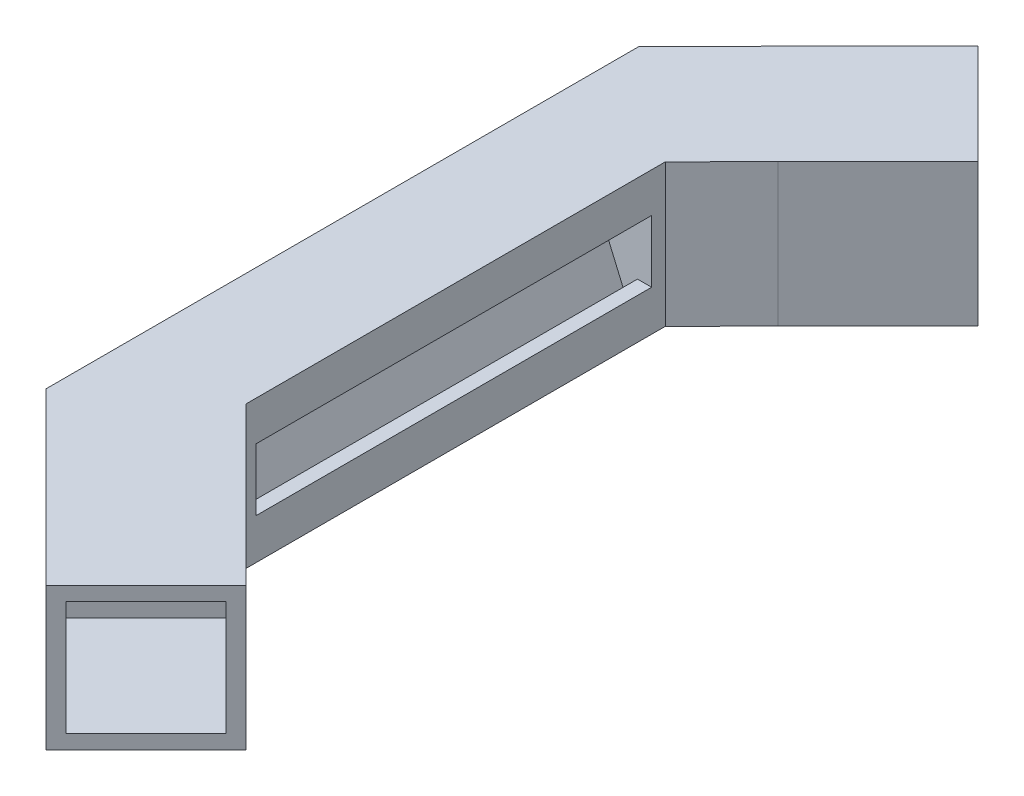
from build123d import *

# Parameters (mm, degrees)
EXTRUDE_1_DEPTH          = 2.5
EXTRUDE_2_DEPTH          = 20.2
EXTRUDE_3_DEPTH          = 2.5
CUT_EXTRUDE_1_DEPTH      = 35
CUT_EXTRUDE_1_DEPTH_BACK = 35


with BuildPart() as part:
    # 스케치1 → 보스-돌출1 (new body)
    with BuildSketch(Plane(origin=(0, 0, 0), x_dir=(1, 0, 0), z_dir=(0, 1, 0))):
        Polygon((-40.78505036, -82.204604484), (-58.462719889, -64.526934954), (-70.873239565, -52.116415278), (-70.873239565, 52.78521642), (-58.606071899, 65.106091447), (-40.92840237, 82.783760977), (-23.25073284, 65.106091447), (-40.92391218, 47.432912107), (-50.873239565, 37.425795029), (-50.873239565, -36.761076219), (-40.78505036, -46.849265425), (-23.10738083, -64.526934954), align=None)
    extrude(amount=EXTRUDE_1_DEPTH)

    # 스케치2 → 보스-돌출2 (add)
    with BuildSketch(Plane(origin=(0, 2.5, 0), x_dir=(1, 0, 0), z_dir=(0, 1, 0))):
        Polygon((-25.018499793, 66.8738584), (-42.694238669, 49.198119524), (-56.836374293, 63.340255148), (-39.160635417, 81.015994024), (-40.92840237, 82.783760977), (-58.606071899, 65.106091447), (-70.873239565, 52.78521642), (-70.873239565, -52.116415278), (-40.78505036, -82.204604484), (-39.017283407, -80.436837531), (-56.694952937, -62.759168001), (-42.552817313, -48.617032378), (-24.875147783, -66.294701907), (-23.10738083, -64.526934954), (-50.873239565, -36.761076219), (-50.873239565, 37.425795029), (-40.92391218, 47.432912107), (-23.25073284, 65.106091447), align=None)
    extrude(amount=EXTRUDE_2_DEPTH)

    # 스케치3 → 보스-돌출3 (add)
    with BuildSketch(Plane(origin=(0, 22.7, 0), x_dir=(1, 0, 0), z_dir=(0, 1, 0))):
        Polygon((-40.78505036, -82.204604484), (-23.10738083, -64.526934954), (-50.873239565, -36.761076219), (-50.873239565, 37.425795029), (-40.92391218, 47.432912107), (-23.25073284, 65.106091447), (-40.92840237, 82.783760977), (-58.606071899, 65.106091447), (-70.873239565, 52.78521642), (-70.873239565, -52.116415278), align=None)
    extrude(amount=EXTRUDE_3_DEPTH)

    # 스케치4 → 컷-돌출1 (cut, two sides: drawn at the far end of the back side and taken through both)
    with BuildSketch(Plane.XY.offset(-CUT_EXTRUDE_1_DEPTH_BACK)):
        Polygon((-50.873239565, 18.2), (-50.873239565, 16.507811734), (-50.873239565, 8.892188266), (-50.873239565, 7.2), (-53.373239565, 7.2), (-53.373239565, 2.2), (-54.873239565, 2.2), (-59.373239565, 12.7), (-54.873239565, 23.2), (-53.373239565, 23.2), (-53.373239565, 18.2), align=None)
        Polygon((-70.873239565, 18.2), (-68.373239565, 18.2), (-68.373239565, 23.2), (-66.873239565, 23.2), (-62.373239565, 12.7), (-66.873239565, 2.2), (-68.373239565, 2.2), (-68.373239565, 7.2), (-70.873239565, 7.2), align=None)
    extrude(amount=CUT_EXTRUDE_1_DEPTH + CUT_EXTRUDE_1_DEPTH_BACK, mode=Mode.SUBTRACT)


solid = part.part
